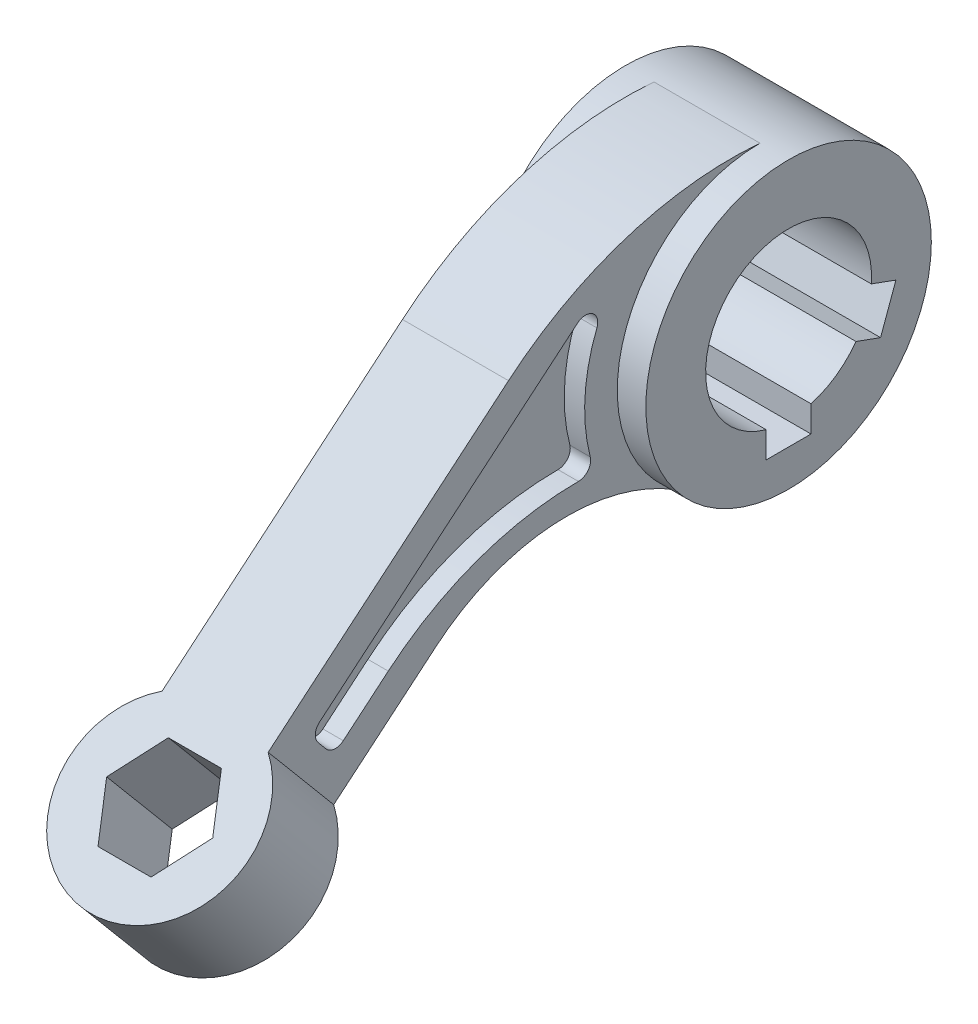
from build123d import *

# Parameters (mm, degrees)
BOSS_EXTRUDE2_DEPTH = 13
BOSS_EXTRUDE3_DEPTH = 20
BOSS_EXTRUDE4_DEPTH = 8
SKETCH2_R           = 22
BOSS_EXTRUDE5_DEPTH = 12.5
CUT_EXTRUDE1_DEPTH  = 12.5


with BuildPart() as part:
    # Sketch1 → Boss-Extrude2 (new, symmetric)
    with BuildSketch(Plane(origin=(0, 0, 0), x_dir=(0, 0, -1), z_dir=(1, 0, 0))):
        with BuildLine():
            ThreePointArc((0, 35), (-32.769963209, 31.299429366), (-61.665057093, 15.404830876))
            Line((-61.665057093, 15.404830876), (-134.181781084, -45.443925478))
            Line((-134.181781084, -45.443925478), (-118.112090842, -64.595036556))
            Line((-118.112090842, -64.595036556), (-79.531665184, -32.222215616))
            ThreePointArc((-79.531665184, -32.222215616), (-50.616442429, -20.628497988), (-20.449595974, -28.40447191))
            ThreePointArc((-20.449595974, -28.40447191), (-33.310332608, 10.743451102), (0, 35))
        make_face()
        with BuildLine():
            Line((-107.958660037, -33.883372594), (-44.65586319, 19.233980892))
            ThreePointArc((-44.65586319, 19.233980892), (-43.34571286, 19.832159244), (-41.9077315, 19.751407541))
            ThreePointArc((-41.9077315, 19.751407541), (-40.085906415, 18.184292753), (-39.998801846, 15.782770696))
            ThreePointArc((-39.998801846, 15.782770696), (-42.92008559, 2.620353591), (-41.621711579, -10.799681718))
            ThreePointArc((-41.621711579, -10.799681718), (-42.152723603, -13.388818271), (-44.52547273, -14.553147883))
            ThreePointArc((-44.52547273, -14.553147883), (-69.329263161, -18.927231696), (-91.141343442, -31.520634046))
            Line((-91.141343442, -31.520634046), (-102.17357155, -40.777772582))
            ThreePointArc((-102.17357155, -40.777772582), (-104.363401607, -41.468223347), (-106.400067708, -40.408002082))
            Line((-106.400067708, -40.408002082), (-108.328430537, -38.109868752))
            ThreePointArc((-108.328430537, -38.109868752), (-109.018881302, -35.920038695), (-107.958660037, -33.883372594))
        make_face(mode=Mode.SUBTRACT)
    extrude(amount=BOSS_EXTRUDE2_DEPTH, both=True)

    # Sketch1<4> → Boss-Extrude3 (add, symmetric)
    with BuildSketch(Plane(origin=(0, 0, 0), x_dir=(0, 0, -1), z_dir=(1, 0, 0))):
        with BuildLine():
            ThreePointArc((35, 0), (24.748737342, 24.748737342), (0, 35))
            ThreePointArc((0, 35), (-33.310332608, 10.743451102), (-20.449595974, -28.40447191))
            ThreePointArc((-20.449595974, -28.40447191), (15.957194943, -31.150729198), (35, 0))
        make_face()
        with BuildLine():
            Line((26.313118929, -3.724214312), (22.550897352, -14.060833141))
            Line((22.550897352, -14.060833141), (16.517461106, -11.864841937))
            ThreePointArc((16.517461106, -11.864841937), (11.664928714, -16.659244691), (5.5, -19.579351255))
            Line((5.5, -19.579351255), (5.5, -26))
            Line((5.5, -26), (-5.5, -26))
            Line((-5.5, -26), (-5.5, -19.579351255))
            ThreePointArc((-5.5, -19.579351255), (-11.664928714, 16.659244691), (20.279682682, -1.528223108))
            Line((20.279682682, -1.528223108), (26.313118929, -3.724214312))
        make_face(mode=Mode.SUBTRACT)
    extrude(amount=BOSS_EXTRUDE3_DEPTH, both=True)

    # Sketch1<5> → Boss-Extrude4 (add, symmetric)
    with BuildSketch(Plane(origin=(0, 0, 0), x_dir=(0, 0, -1), z_dir=(1, 0, 0))):
        with BuildLine():
            ThreePointArc((-41.9077315, 19.751407541), (-43.34571286, 19.832159244), (-44.65586319, 19.233980892))
            Line((-44.65586319, 19.233980892), (-107.958660037, -33.883372594))
            ThreePointArc((-107.958660037, -33.883372594), (-109.018881302, -35.920038695), (-108.328430537, -38.109868752))
            Line((-108.328430537, -38.109868752), (-106.400067708, -40.408002082))
            ThreePointArc((-106.400067708, -40.408002082), (-104.363401607, -41.468223347), (-102.17357155, -40.777772582))
            Line((-102.17357155, -40.777772582), (-91.141343442, -31.520634046))
            ThreePointArc((-91.141343442, -31.520634046), (-69.329263161, -18.927231696), (-44.52547273, -14.553147883))
            ThreePointArc((-44.52547273, -14.553147883), (-42.152723603, -13.388818271), (-41.621711579, -10.799681718))
            ThreePointArc((-41.621711579, -10.799681718), (-42.92008559, 2.620353591), (-39.998801846, 15.782770696))
            ThreePointArc((-39.998801846, 15.782770696), (-40.085906415, 18.184292753), (-41.9077315, 19.751407541))
        make_face()
    extrude(amount=BOSS_EXTRUDE4_DEPTH, both=True)

    # Sketch2 → Boss-Extrude5 (add, symmetric)
    with BuildSketch(Plane(origin=(0, 29.828483461, 25.029069471), x_dir=(-1, 0, 0), z_dir=(0, -0.7660444431189768, -0.6427876096865408))):
        with Locations((0, -132)):
            Circle(SKETCH2_R)
        Polygon((6.5, -120.741669751), (-6.5, -120.741669751), (-13, -132), (-6.5, -143.258330249), (6.5, -143.258330249), (13, -132), align=None, mode=Mode.SUBTRACT)
    extrude(amount=BOSS_EXTRUDE5_DEPTH, both=True)

    # Sketch2<2> → Cut-Extrude1 (cut, symmetric)
    with BuildSketch(Plane(origin=(0, 29.828483461, 25.029069471), x_dir=(-1, 0, 0), z_dir=(0, -0.7660444431189768, -0.6427876096865408))):
        Polygon((13, -132), (6.5, -120.741669751), (-6.5, -120.741669751), (-13, -132), (-6.5, -143.258330249), (6.5, -143.258330249), align=None)
    extrude(amount=CUT_EXTRUDE1_DEPTH, both=True, mode=Mode.SUBTRACT)


solid = part.part
